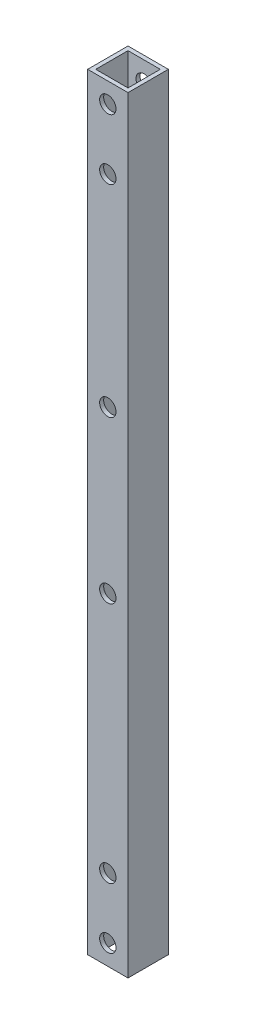
from build123d import *

# Parameters (mm, degrees)
SKETCH1_W           = 10
SKETCH1_H           = 10
SKETCH1_W_2         = 8
SKETCH1_H_2         = 8
BOSS_EXTRUDE1_DEPTH = 190
SKETCH2_R           = 2.025
CUT_EXTRUDE1_DEPTH  = 191.328663107
SKETCH3_R           = 2.025
CUT_EXTRUDE2_DEPTH  = 191.328663107


with BuildPart() as part:
    # Sketch1 → Boss-Extrude1 (new body)
    with BuildSketch(Plane(origin=(0, 0, 0), x_dir=(1, 0, 0), z_dir=(0, 1, 0))):
        Rectangle(SKETCH1_W, SKETCH1_H)
        Rectangle(SKETCH1_W_2, SKETCH1_H_2, mode=Mode.SUBTRACT)
    extrude(amount=BOSS_EXTRUDE1_DEPTH)

    # Sketch2 → Cut-Extrude1 (cut, through all)
    with BuildSketch(Plane.XY.offset(5)):
        with Locations((0, 120)):
            Circle(SKETCH2_R)
        with Locations((0, 80)):
            Circle(SKETCH2_R)
    extrude(amount=-CUT_EXTRUDE1_DEPTH, mode=Mode.SUBTRACT)

    # Sketch3 → Cut-Extrude2 (cut, through all)
    with BuildSketch(Plane.XY.offset(5)):
        with Locations((0, 185)):
            Circle(SKETCH3_R)
        with Locations((0, 170)):
            Circle(SKETCH3_R)
        with Locations((0, 5)):
            Circle(SKETCH3_R)
        with Locations((0, 20)):
            Circle(SKETCH3_R)
    extrude(amount=-CUT_EXTRUDE2_DEPTH, mode=Mode.SUBTRACT)


solid = part.part
